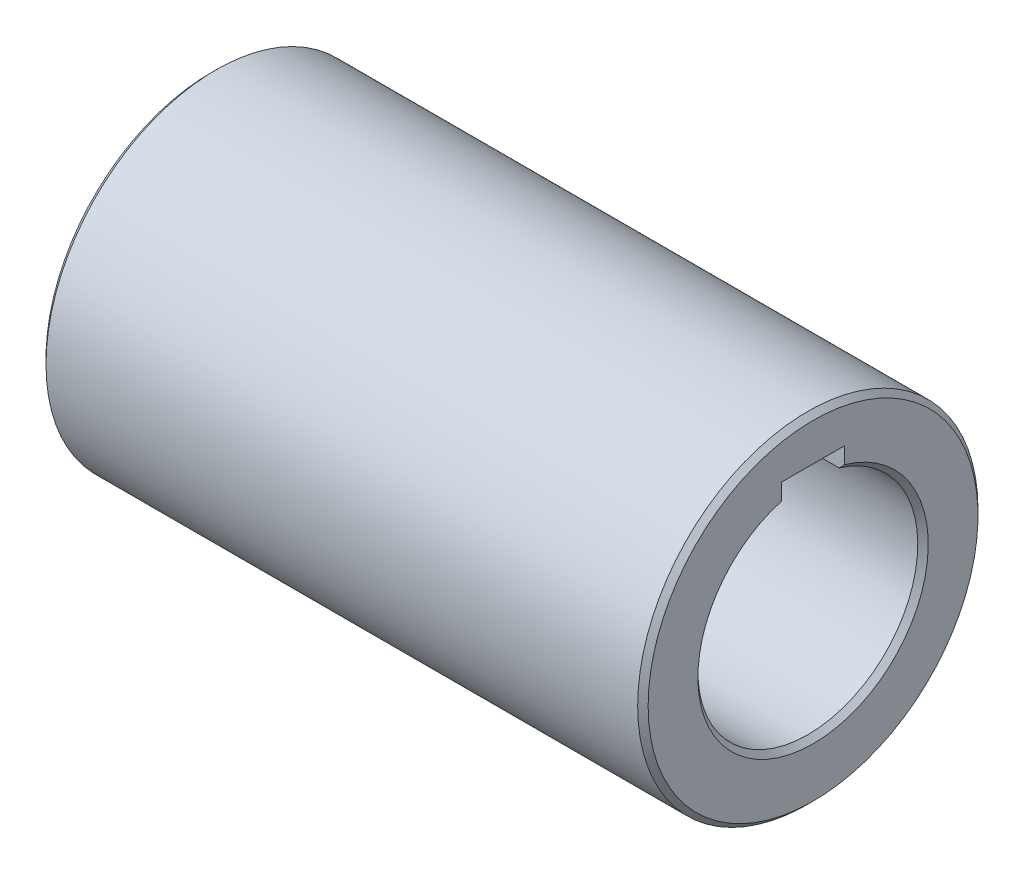
from build123d import *

# Parameters (mm, degrees)
CHAMFER1_SIZE      = 1
SKETCH2_W          = 12
SKETCH2_H          = 8.3
CUT_EXTRUDE1_DEPTH = 100


with BuildPart() as part:
    # Sketch1 → Revolve1 (revolve)
    with BuildSketch(Plane.XY, mode=Mode.PRIVATE) as revolve1_sk:
        Polygon((0, 27.5), (0, 32.5), (115, 32.5), (115, 21), (63, 21), (63, 27.5), align=None)
    revolve(revolve1_sk.sketch.rotate(Axis((0, 0, 0), (1, 0, 0)), 90), axis=Axis((0, 0, 0), (1, 0, 0)))

    # Chamfer1
    chamfer1_edges = [part.edges().sort_by_distance(p)[0] for p in [
        (115, 0, -21),
        (115, 0, -32.5),
        (0, 0, -32.5),
        (0, 0, -27.5),
    ]]
    chamfer(chamfer1_edges, length=CHAMFER1_SIZE)

    # Sketch2 → Cut-Extrude1 (cut)
    with BuildSketch(Plane(origin=(115, 0, 0), x_dir=(0, 0, -1), z_dir=(1, 0, 0))):
        with Locations((0, 20.15)):
            Rectangle(SKETCH2_W, SKETCH2_H)
    extrude(amount=-CUT_EXTRUDE1_DEPTH, mode=Mode.SUBTRACT)


solid = part.part
